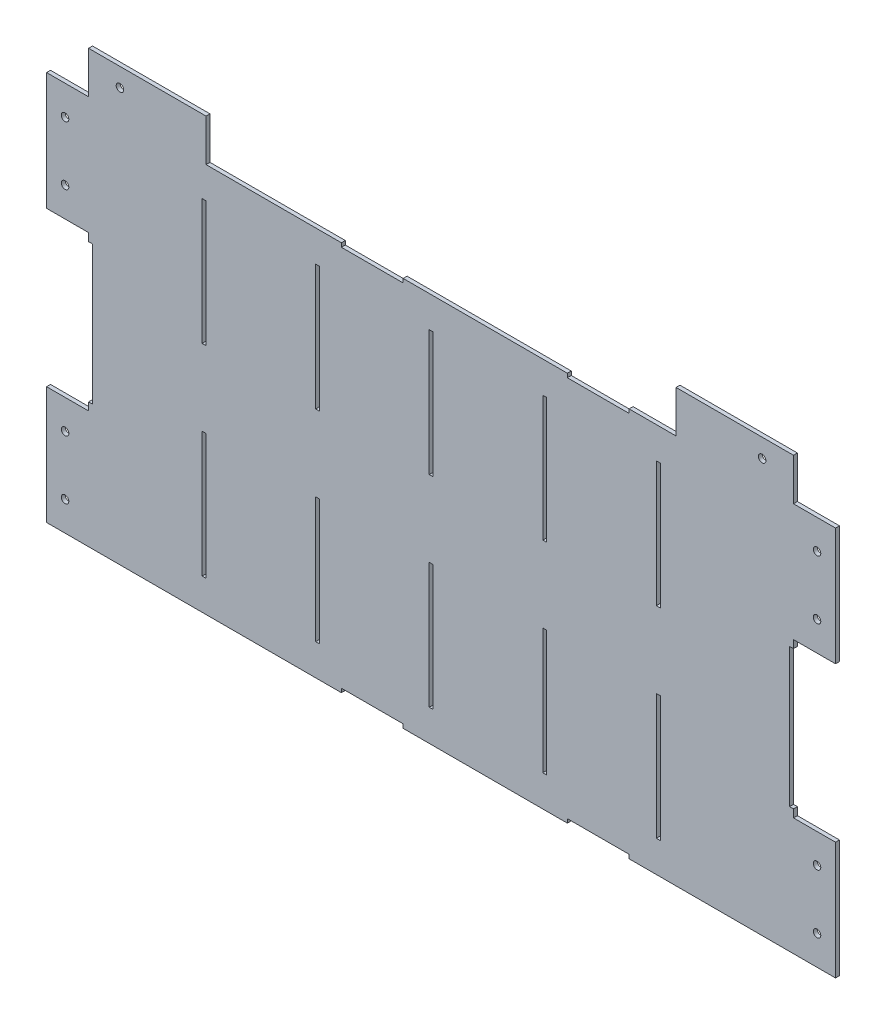
from build123d import *

# Parameters (mm, degrees)
SKETCH1_W                 = 570.860988324
SKETCH1_H                 = 315.575
BOSS_EXTRUDE1_DEPTH       = 3.175
SKETCH2_W                 = 3.175
SKETCH2_H                 = 101.6
CUT_EXTRUDE1_DEPTH        = 3.175
SKETCH7_W                 = 50
SKETCH7_H                 = 3.175
CUT_EXTRUDE5_DEPTH        = 3.175
LPATTERN2_COUNT           = 5
LPATTERN2_PITCH           = 91.96
LPATTERN2_COPY_1_SKETCH_W = 3.175
LPATTERN2_COPY_1_SKETCH_H = 101.6
LPATTERN2_COPY_1_DEPTH    = 3.175
LPATTERN2_COPY_2_SKETCH_W = 3.175
LPATTERN2_COPY_2_SKETCH_H = 101.6
LPATTERN2_COPY_2_DEPTH    = 3.175
LPATTERN2_COPY_3_SKETCH_W = 3.175
LPATTERN2_COPY_3_SKETCH_H = 101.6
LPATTERN2_COPY_3_DEPTH    = 3.175
LPATTERN2_COPY_4_SKETCH_W = 3.175
LPATTERN2_COPY_4_SKETCH_H = 101.6
LPATTERN2_COPY_4_DEPTH    = 3.175
SKETCH9_W                 = 95.12808
SKETCH9_H                 = 34.036
SKETCH9_R                 = 3.048
SKETCH9_W_2               = 34.036
SKETCH9_H_2               = 95.25
BOSS_EXTRUDE3_DEPTH       = 3.175
SKETCH10_W                = 3.175
SKETCH10_H                = 112.375
CUT_EXTRUDE6_DEPTH        = 373.646181611


with BuildPart() as part:
    # Sketch1 → Boss-Extrude1 (new body)
    with BuildSketch(Plane.XY):
        Rectangle(SKETCH1_W, SKETCH1_H)
    extrude(amount=BOSS_EXTRUDE1_DEPTH)

    # Sketch2 → Cut-Extrude1 (cut)
    with BuildSketch(Plane.XY.offset(3.175)):
        with Locations((-191.887994162, -81.5875)):
            Rectangle(SKETCH2_W, SKETCH2_H)
    cut_extrude1 = extrude(amount=-CUT_EXTRUDE1_DEPTH, mode=Mode.SUBTRACT)

    # Sketch7 → Cut-Extrude5 (cut)
    with BuildSketch(Plane.XY.offset(3.175)):
        with Locations((127.304934912, -156.2)):
            Rectangle(SKETCH7_W, SKETCH7_H)
        with Locations((-55.695065088, -156.2)):
            Rectangle(SKETCH7_W, SKETCH7_H)
    cut_extrude5 = extrude(amount=-CUT_EXTRUDE5_DEPTH, mode=Mode.SUBTRACT)

    # Mirror3: Cut-Extrude1 across plane
    add(cut_extrude1.mirror(Plane.ZX), mode=Mode.SUBTRACT)

    # LPattern2: Cut-Extrude1 ×5
    with Locations(*[(i * LPATTERN2_PITCH, 0, 0) for i in range(1, LPATTERN2_COUNT)]):
        add(cut_extrude1, mode=Mode.SUBTRACT)

    # LPattern2 copy 1 sketch → LPattern2 copy 1 (cut)
    with BuildSketch(Plane(origin=(91.96, 0, 3.175), x_dir=(1, 0, 0), z_dir=(0, 0, 1))):
        with Locations((-191.887994162, 81.5875)):
            Rectangle(LPATTERN2_COPY_1_SKETCH_W, LPATTERN2_COPY_1_SKETCH_H)
    extrude(amount=-LPATTERN2_COPY_1_DEPTH, mode=Mode.SUBTRACT)

    # LPattern2 copy 2 sketch → LPattern2 copy 2 (cut)
    with BuildSketch(Plane(origin=(183.92, 0, 3.175), x_dir=(1, 0, 0), z_dir=(0, 0, 1))):
        with Locations((-191.887994162, 81.5875)):
            Rectangle(LPATTERN2_COPY_2_SKETCH_W, LPATTERN2_COPY_2_SKETCH_H)
    extrude(amount=-LPATTERN2_COPY_2_DEPTH, mode=Mode.SUBTRACT)

    # LPattern2 copy 3 sketch → LPattern2 copy 3 (cut)
    with BuildSketch(Plane(origin=(275.88, 0, 3.175), x_dir=(1, 0, 0), z_dir=(0, 0, 1))):
        with Locations((-191.887994162, 81.5875)):
            Rectangle(LPATTERN2_COPY_3_SKETCH_W, LPATTERN2_COPY_3_SKETCH_H)
    extrude(amount=-LPATTERN2_COPY_3_DEPTH, mode=Mode.SUBTRACT)

    # LPattern2 copy 4 sketch → LPattern2 copy 4 (cut)
    with BuildSketch(Plane(origin=(367.84, 0, 3.175), x_dir=(1, 0, 0), z_dir=(0, 0, 1))):
        with Locations((-191.887994162, 81.5875)):
            Rectangle(LPATTERN2_COPY_4_SKETCH_W, LPATTERN2_COPY_4_SKETCH_H)
    extrude(amount=-LPATTERN2_COPY_4_DEPTH, mode=Mode.SUBTRACT)

    # Sketch9 → Boss-Extrude3 (add)
    # profile 1 of 3: a face of its own
    with BuildSketch(Plane(origin=(0, 0, 0), x_dir=(-1, 0, 0), z_dir=(0, 0, -1))):
        with Locations((-237.866454162, 174.8055)):
            Rectangle(SKETCH9_W, SKETCH9_H)
        with Locations((-260.030494162, 176.8375)):
            Circle(SKETCH9_R, mode=Mode.SUBTRACT)
    # profile 2 of 3: a face of its own
    with BuildSketch(Plane(origin=(0, 0, 0), x_dir=(-1, 0, 0), z_dir=(0, 0, -1))):
        with Locations((-302.448494162, 110.1625)):
            Rectangle(SKETCH9_W_2, SKETCH9_H_2)
        with Locations((-304.480494162, 86.35)):
            Circle(SKETCH9_R, mode=Mode.SUBTRACT)
        with Locations((-304.480494162, 133.975)):
            Circle(SKETCH9_R, mode=Mode.SUBTRACT)
    # profile 3 of 3: a face of its own
    with BuildSketch(Plane(origin=(0, 0, 0), x_dir=(-1, 0, 0), z_dir=(0, 0, -1))):
        with Locations((-302.448494162, -110.1625)):
            Rectangle(SKETCH9_W_2, SKETCH9_H_2)
        with Locations((-304.480494162, -133.975)):
            Circle(SKETCH9_R, mode=Mode.SUBTRACT)
        with Locations((-304.480494162, -86.35)):
            Circle(SKETCH9_R, mode=Mode.SUBTRACT)
    boss_extrude3 = extrude(amount=-BOSS_EXTRUDE3_DEPTH)

    # Mirror4: Boss-Extrude3 across plane
    add(boss_extrude3.mirror(Plane(origin=(0, 0, 0), x_dir=(0, 0, 1), z_dir=(1, 0, 0))))

    # Mirror5: Cut-Extrude5 across plane
    add(cut_extrude5.mirror(Plane.ZX), mode=Mode.SUBTRACT)

    # Sketch10 → Cut-Extrude6 (cut, through all)
    with BuildSketch(Plane(origin=(0, 0, 0), x_dir=(-1, 0, 0), z_dir=(0, 0, -1))):
        with Locations((-283.842994162, 0)):
            Rectangle(SKETCH10_W, SKETCH10_H)
    cut_extrude6 = extrude(amount=-CUT_EXTRUDE6_DEPTH, mode=Mode.SUBTRACT)

    # Mirror6: Cut-Extrude6 across plane
    add(cut_extrude6.mirror(Plane(origin=(0, 0, 0), x_dir=(0, 0, 1), z_dir=(1, 0, 0))), mode=Mode.SUBTRACT)


solid = part.part
